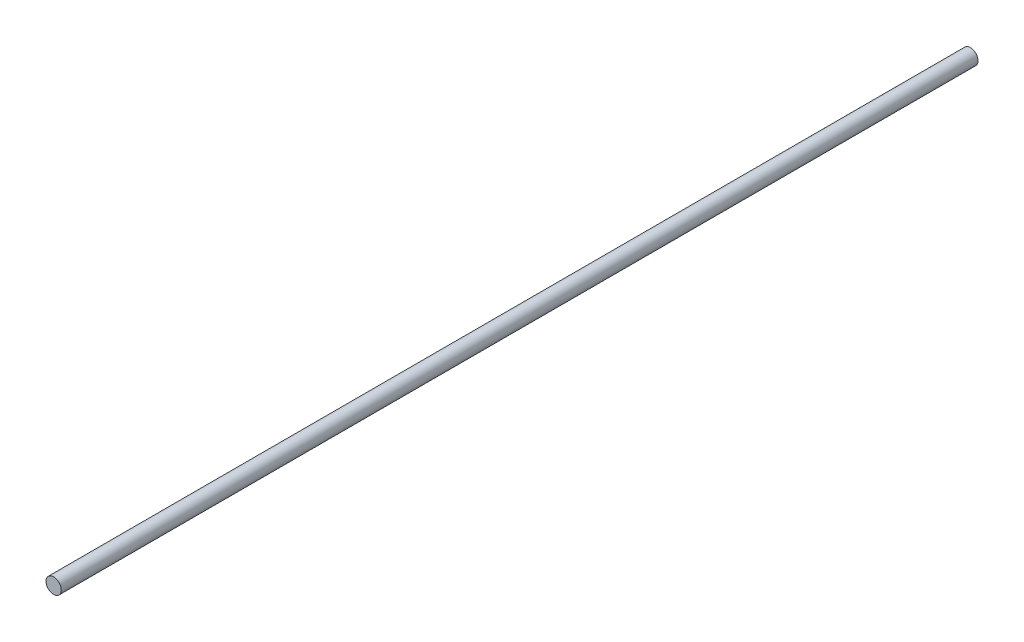
from build123d import *

# Parameters (mm, degrees)
SKETCH1_R           = 3.175
BOSS_EXTRUDE1_DEPTH = 381


with BuildPart() as part:
    # Sketch1 → Boss-Extrude1 (new body)
    with BuildSketch(Plane.XY):
        Circle(SKETCH1_R)
    extrude(amount=BOSS_EXTRUDE1_DEPTH)


solid = part.part
